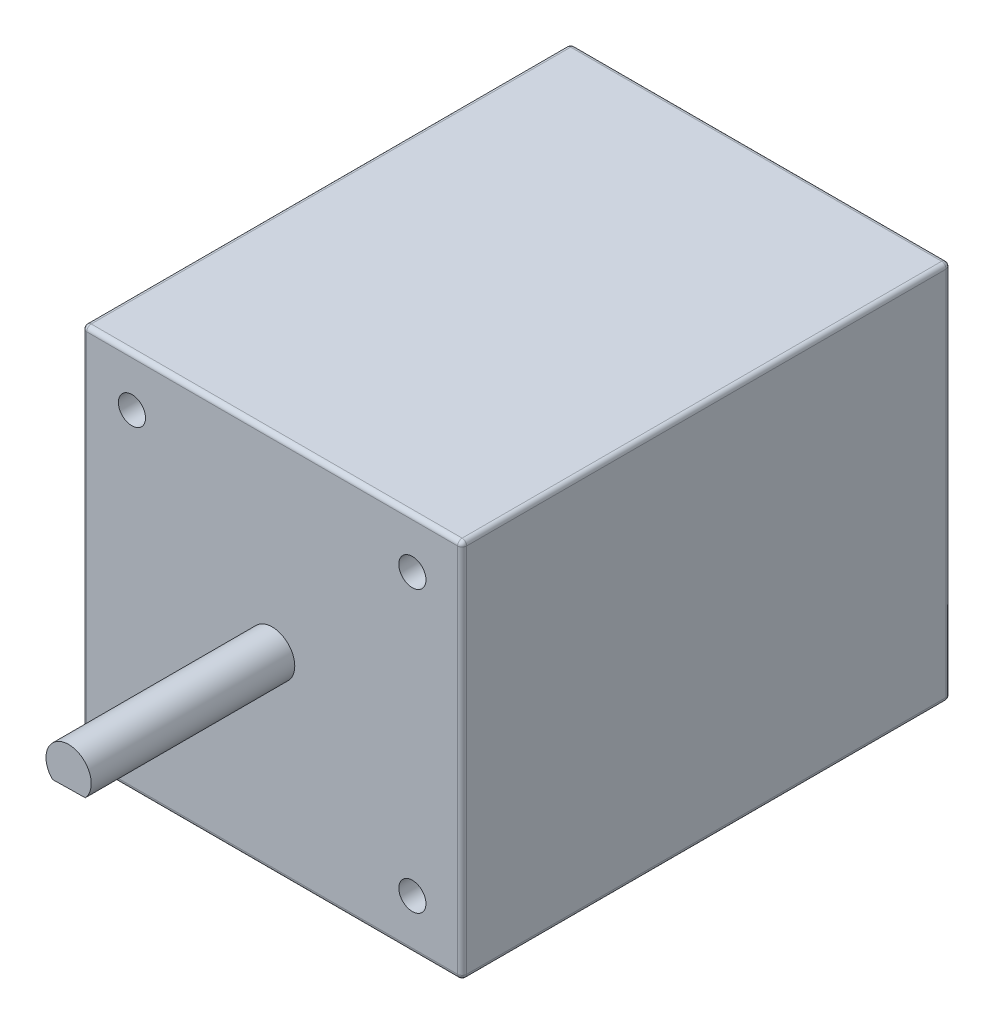
from build123d import *

# Parameters (mm, degrees)
SKETCH_1_W          = 42
SKETCH_1_H          = 42
EXTRUDE_1_DEPTH     = 54
EXTRUDE_START       = 54
EXTRUDE_2_DEPTH     = 22.5
FILLET_1_R          = 0.5
CUT_EXTRUDE_START   = 54
SKETCH_3_R          = 1.5
CUT_EXTRUDE_1_DEPTH = 10


with BuildPart() as part:
    # 草图1 → 凸台-拉伸1 (new body)
    with BuildSketch(Plane.XY):
        Rectangle(SKETCH_1_W, SKETCH_1_H)
    extrude(amount=EXTRUDE_1_DEPTH)

    # 草图2 → 凸台-拉伸2 (add)
    with BuildSketch(Plane.XY.offset(EXTRUDE_START)):
        with BuildLine():
            Line((-1.785837809, -1.749509451), (1.844440663, -1.687613298))
            ThreePointArc((1.844440663, -1.687613298), (-0.042618741, 2.499636702), (-1.785837809, -1.749509451))
        make_face()
    extrude(amount=EXTRUDE_2_DEPTH)

    # 圆角1
    fillet_1_edges = [part.edges().sort_by_distance(p)[0] for p in [
        (-21, 0, 54),
        (0, -21, 54),
        (21, 0, 54),
        (0, -21, 0),
        (-21, 0, 0),
        (0, 21, 0),
        (21, 0, 0),
        (21, -21, 27),
        (-21, -21, 27),
        (-21, 21, 27),
        (21, 21, 27),
        (0, 21, 54),
    ]]
    fillet(fillet_1_edges, radius=FILLET_1_R)

    # 草图3 → 切除-拉伸1 (cut)
    with BuildSketch(Plane.XY.offset(CUT_EXTRUDE_START)):
        with Locations(Location((-15.5, 15.5, 0), (0, 0, 180))):
            Circle(SKETCH_3_R)
        with Locations(Location((15.5, 15.5, 0), (0, 0, 180))):
            Circle(SKETCH_3_R)
        with Locations(Location((15.5, -15.5, 0), (0, 0, 180))):
            Circle(SKETCH_3_R)
        with Locations(Location((-15.5, -15.5, 0), (0, 0, 180))):
            Circle(SKETCH_3_R)
    extrude(amount=-CUT_EXTRUDE_1_DEPTH, mode=Mode.SUBTRACT)


solid = part.part
